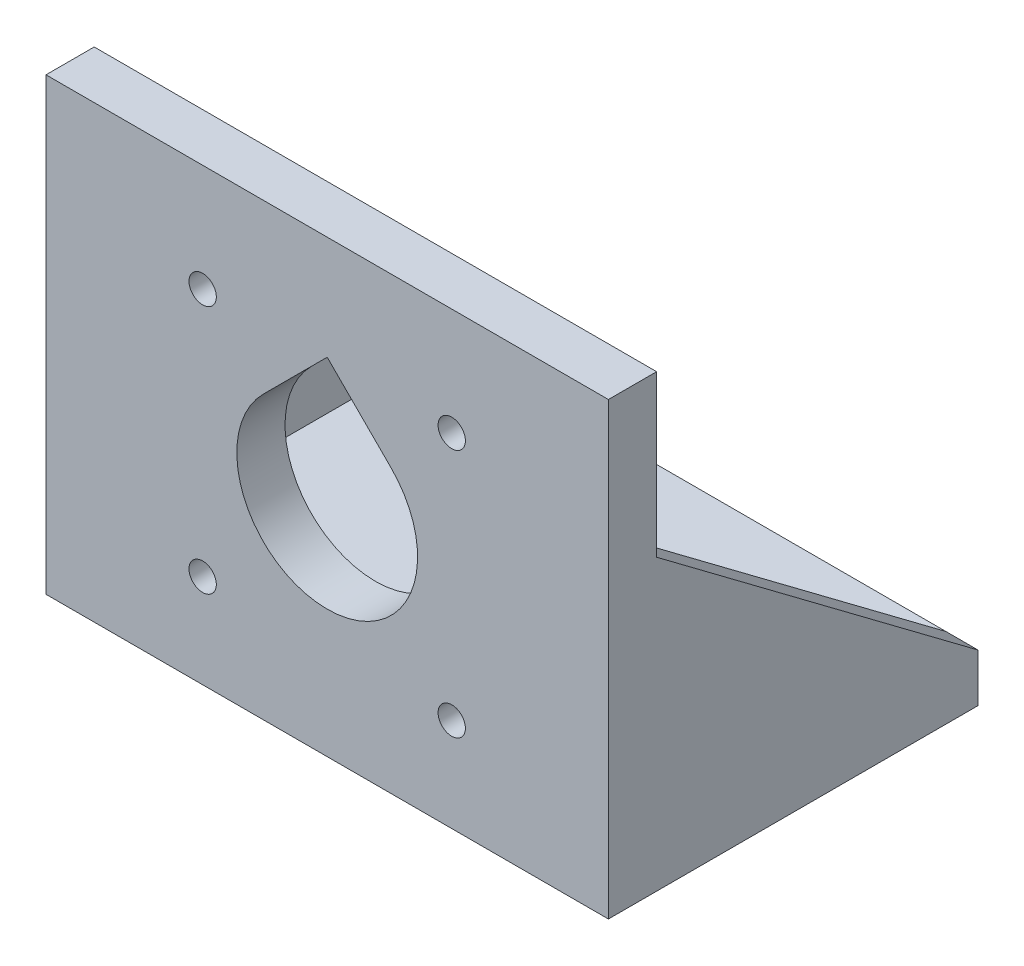
from build123d import *

# Parameters (mm, degrees)
SKETCH_01_W                   = 70
SKETCH_01_H                   = 56
EXTRUDE_01_DEPTH              = 6
SKETCH_02_W                   = 70
SKETCH_02_H                   = 46
EXTRUDE_02_DEPTH              = 6
EXTRUDE_03_DEPTH              = 4
EXTRUDE_START                 = 66
EXTRUDE_04_DEPTH              = 4
CUT_EXTRUDE_05_4_3_DEPTH      = 99.163129534
CUT_EXTRUDE_05_4_3_DEPTH_BACK = 99.163129534
SKETCH_05_R                   = 11.25
SKETCH_05_R_2                 = 1.7
CUT_EXTRUDE_06_DEPTH          = 99.163129534
CUT_EXTRUDE_06_DEPTH_BACK     = 99.163129534
CUT_EXTRUDE_07_4_4_DEPTH      = 99.163129534
CUT_EXTRUDE_07_4_4_DEPTH_BACK = 99.163129534
SKETCH_07_R                   = 2.25


with BuildPart() as part:
    # 01_Пластина_эскиз → 01_Передняя_пластина (new body)
    with BuildSketch(Plane.XY):
        with Locations((35, 28)):
            Rectangle(SKETCH_01_W, SKETCH_01_H)
    extrude(amount=EXTRUDE_01_DEPTH)

    # 02_Полка_эскиз → 02_Полка (add)
    with BuildSketch(Plane(origin=(0, 0, 0), x_dir=(1, 0, 0), z_dir=(0, 1, 0))):
        with Locations((35, 17)):
            Rectangle(SKETCH_02_W, SKETCH_02_H)
    extrude(amount=EXTRUDE_02_DEPTH)

    # 03_Косынка_левая_эскиз → 03_Косынка_левая (add)
    with BuildSketch(Plane(origin=(0, 0, 0), x_dir=(0, 0, -1), z_dir=(1, 0, 0))):
        Polygon((40, 6), (0, 6), (0, 36), align=None)
    extrude(amount=EXTRUDE_03_DEPTH)

    # 04_Косынка_правая_эскиз → 04_Косынка_правая (add)
    with BuildSketch(Plane(origin=(0, 0, 0), x_dir=(0, 0, -1), z_dir=(1, 0, 0)).offset(EXTRUDE_START)):
        Polygon((40, 6), (0, 6), (0, 36), align=None)
    extrude(amount=EXTRUDE_04_DEPTH)

    # 05_Мотор_передний_фланец_эскиз → 05_Буртик_и_4_отверстия_М3 (cut, two sides: drawn at the far end of the back side and taken through both)
    with BuildSketch(Plane.XY.offset(-CUT_EXTRUDE_05_4_3_DEPTH_BACK)):
        with Locations((35, 27.15)):
            Circle(SKETCH_05_R)
        with Locations((19.5, 11.65)):
            Circle(SKETCH_05_R_2)
        with Locations((19.5, 42.65)):
            Circle(SKETCH_05_R_2)
        with Locations((50.5, 11.65)):
            Circle(SKETCH_05_R_2)
        with Locations((50.5, 42.65)):
            Circle(SKETCH_05_R_2)
    extrude(amount=CUT_EXTRUDE_05_4_3_DEPTH + CUT_EXTRUDE_05_4_3_DEPTH_BACK, mode=Mode.SUBTRACT)

    # 06_Свод_45град_эскиз → 06_Свод_отверстия_для_печати (cut, two sides: drawn at the far end of the back side and taken through both)
    with BuildSketch(Plane.XY.offset(-CUT_EXTRUDE_06_DEPTH_BACK)):
        Polygon((27.045048712, 35.104951288), (42.954951288, 35.104951288), (35, 43.059902577), align=None)
    extrude(amount=CUT_EXTRUDE_06_DEPTH + CUT_EXTRUDE_06_DEPTH_BACK, mode=Mode.SUBTRACT)

    # 07_Крепление_полки_эскиз → 07_4_отверстия_М4 (cut, two sides: drawn at the far end of the back side and taken through both)
    with BuildSketch(Plane(origin=(0, 0, 0), x_dir=(1, 0, 0), z_dir=(0, 1, 0)).offset(-CUT_EXTRUDE_07_4_4_DEPTH_BACK)):
        with Locations(Location((8.5, 12, 0), (0, 0, 270))):
            Circle(SKETCH_07_R)
        with Locations(Location((8.5, 30, 0), (0, 0, 270))):
            Circle(SKETCH_07_R)
        with Locations(Location((61.5, 12, 0), (0, 0, 270))):
            Circle(SKETCH_07_R)
        with Locations(Location((61.5, 30, 0), (0, 0, 270))):
            Circle(SKETCH_07_R)
    extrude(amount=CUT_EXTRUDE_07_4_4_DEPTH + CUT_EXTRUDE_07_4_4_DEPTH_BACK, mode=Mode.SUBTRACT)


solid = part.part
